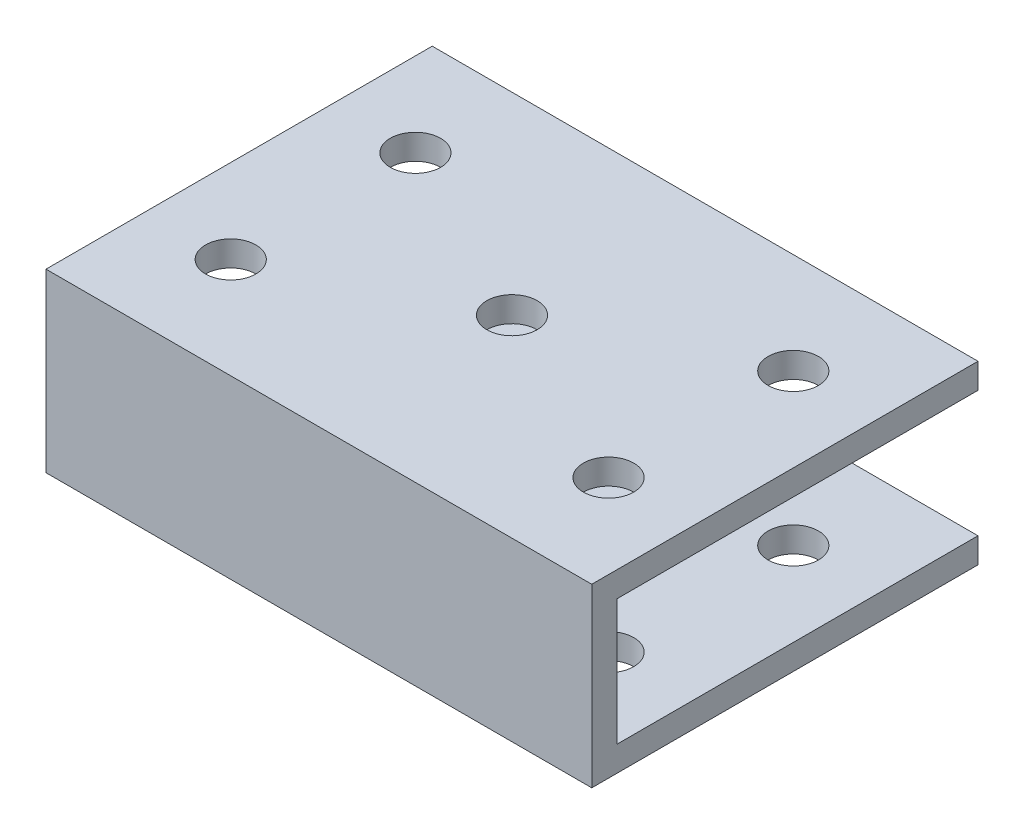
from build123d import *

# Parameters (mm, degrees)
SKETCH_1_W          = 65
SKETCH_1_H          = 46
EXTRUDE_1_DEPTH     = 3
SKETCH_2_W          = 65
SKETCH_2_H          = 15
EXTRUDE_2_DEPTH     = 3
SKETCH_3_W          = 65
SKETCH_3_H          = 46
EXTRUDE_3_DEPTH     = 3
SKETCH_4_R          = 3
CUT_EXTRUDE_1_DEPTH = 83.35289916


with BuildPart() as part:
    # 草图1 → 凸台-拉伸1 (new body)
    with BuildSketch(Plane(origin=(0, 0, 0), x_dir=(1, 0, 0), z_dir=(0, 1, 0))):
        with Locations((32.5, 23)):
            Rectangle(SKETCH_1_W, SKETCH_1_H)
    extrude(amount=EXTRUDE_1_DEPTH)

    # 草图2 → 凸台-拉伸2 (add)
    with BuildSketch(Plane.XY):
        with Locations((32.5, 10.5)):
            Rectangle(SKETCH_2_W, SKETCH_2_H)
    extrude(amount=-EXTRUDE_2_DEPTH)

    # 草图3 → 凸台-拉伸3 (add)
    with BuildSketch(Plane(origin=(0, 18, 0), x_dir=(1, 0, 0), z_dir=(0, 1, 0))):
        with Locations((32.5, 23)):
            Rectangle(SKETCH_3_W, SKETCH_3_H)
    extrude(amount=EXTRUDE_3_DEPTH)

    # 草图4 → 切除-拉伸1 (cut, through all)
    with BuildSketch(Plane.XZ):
        with Locations(Location((32.5, -23, 0), (0, 0, 270))):
            Circle(SKETCH_4_R)
        with Locations(Location((55, -34, 0), (0, 0, 270))):
            Circle(SKETCH_4_R)
        with Locations(Location((55, -12, 0), (0, 0, 270))):
            Circle(SKETCH_4_R)
        with Locations(Location((10, -34, 0), (0, 0, 270))):
            Circle(SKETCH_4_R)
        with Locations(Location((10, -12, 0), (0, 0, 270))):
            Circle(SKETCH_4_R)
    extrude(amount=-CUT_EXTRUDE_1_DEPTH, mode=Mode.SUBTRACT)


solid = part.part
